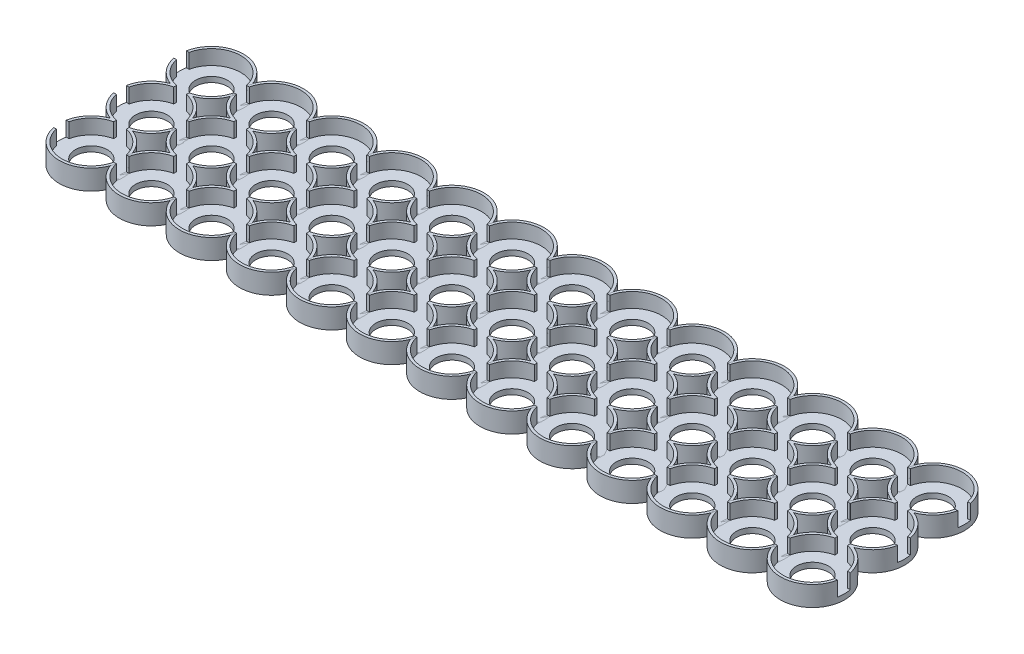
from build123d import *

# Parameters (mm, degrees)
LPATTERN1_COUNT    = 3
LPATTERN1_PITCH    = 22.5
SKETCH5_W          = 45.428267136
SKETCH5_H          = 4.75
CUT_EXTRUDE1_DEPTH = 5.5
LPATTERN2_COUNT    = 13
LPATTERN2_PITCH    = 22.5


with BuildPart() as part:
    # Sketch1 → Revolve1 (revolve)
    with BuildSketch(Plane(origin=(0, 0, 0), x_dir=(0, 0, -1), z_dir=(1, 0, 0))):
        Polygon((-12, 3.75), (-12, -3.75), (-6, -3.75), (-6, -1.75), (-11, -1.75), (-11, 3.75), align=None)
    revolve1 = revolve(axis=Axis((0, 27.077205882, 0), (0, -1, 0)))

    # LPattern1: Revolve1 ×3
    with Locations(*[(0, 0, -i * LPATTERN1_PITCH) for i in range(1, LPATTERN1_COUNT)]):
        add(revolve1)

    # Sketch5 → Cut-Extrude1 (cut)
    with BuildSketch(Plane(origin=(0, 3.75, 0), x_dir=(1, 0, 0), z_dir=(0, 1, 0))):
        Polygon((2.382491434, 9.394835238), (-2.382491434, 9.394835238), (-2.382491434, 20.125), (-23.356319135, 20.125), (-23.356319135, 24.875), (-2.382491434, 24.875), (-2.382491434, 35.605164762), (2.382491434, 35.605164762), (2.382491434, 24.875), (19.692602049, 24.875), (19.692602049, 20.125), (2.382491434, 20.125), align=None)
        with Locations((-0.642185567, 0)):
            Rectangle(SKETCH5_W, SKETCH5_H)
        with Locations((-0.642185567, 45)):
            Rectangle(SKETCH5_W, SKETCH5_H)
    extrude(amount=-CUT_EXTRUDE1_DEPTH, mode=Mode.SUBTRACT)


with BuildPart() as lpattern2_1:
    # LPattern2: pattern copy
    add(part.part.moved(Location(Vector(1, 0, 0) * (1 * LPATTERN2_PITCH))))


with BuildPart() as lpattern2_2:
    # LPattern2: pattern copy
    add(part.part.moved(Location(Vector(1, 0, 0) * (2 * LPATTERN2_PITCH))))


with BuildPart() as lpattern2_3:
    # LPattern2: pattern copy
    add(part.part.moved(Location(Vector(1, 0, 0) * (3 * LPATTERN2_PITCH))))


with BuildPart() as lpattern2_4:
    # LPattern2: pattern copy
    add(part.part.moved(Location(Vector(1, 0, 0) * (4 * LPATTERN2_PITCH))))


with BuildPart() as lpattern2_5:
    # LPattern2: pattern copy
    add(part.part.moved(Location(Vector(1, 0, 0) * (5 * LPATTERN2_PITCH))))


with BuildPart() as lpattern2_6:
    # LPattern2: pattern copy
    add(part.part.moved(Location(Vector(1, 0, 0) * (6 * LPATTERN2_PITCH))))


with BuildPart() as lpattern2_7:
    # LPattern2: pattern copy
    add(part.part.moved(Location(Vector(1, 0, 0) * (7 * LPATTERN2_PITCH))))


with BuildPart() as lpattern2_8:
    # LPattern2: pattern copy
    add(part.part.moved(Location(Vector(1, 0, 0) * (8 * LPATTERN2_PITCH))))


with BuildPart() as lpattern2_9:
    # LPattern2: pattern copy
    add(part.part.moved(Location(Vector(1, 0, 0) * (9 * LPATTERN2_PITCH))))


with BuildPart() as lpattern2_10:
    # LPattern2: pattern copy
    add(part.part.moved(Location(Vector(1, 0, 0) * (10 * LPATTERN2_PITCH))))


with BuildPart() as lpattern2_11:
    # LPattern2: pattern copy
    add(part.part.moved(Location(Vector(1, 0, 0) * (11 * LPATTERN2_PITCH))))


with BuildPart() as lpattern2_12:
    # LPattern2: pattern copy
    add(part.part.moved(Location(Vector(1, 0, 0) * (12 * LPATTERN2_PITCH))))


solid = Compound([part.part, lpattern2_1.part, lpattern2_2.part, lpattern2_3.part, lpattern2_4.part, lpattern2_5.part, lpattern2_6.part, lpattern2_7.part, lpattern2_8.part, lpattern2_9.part, lpattern2_10.part, lpattern2_11.part, lpattern2_12.part])
